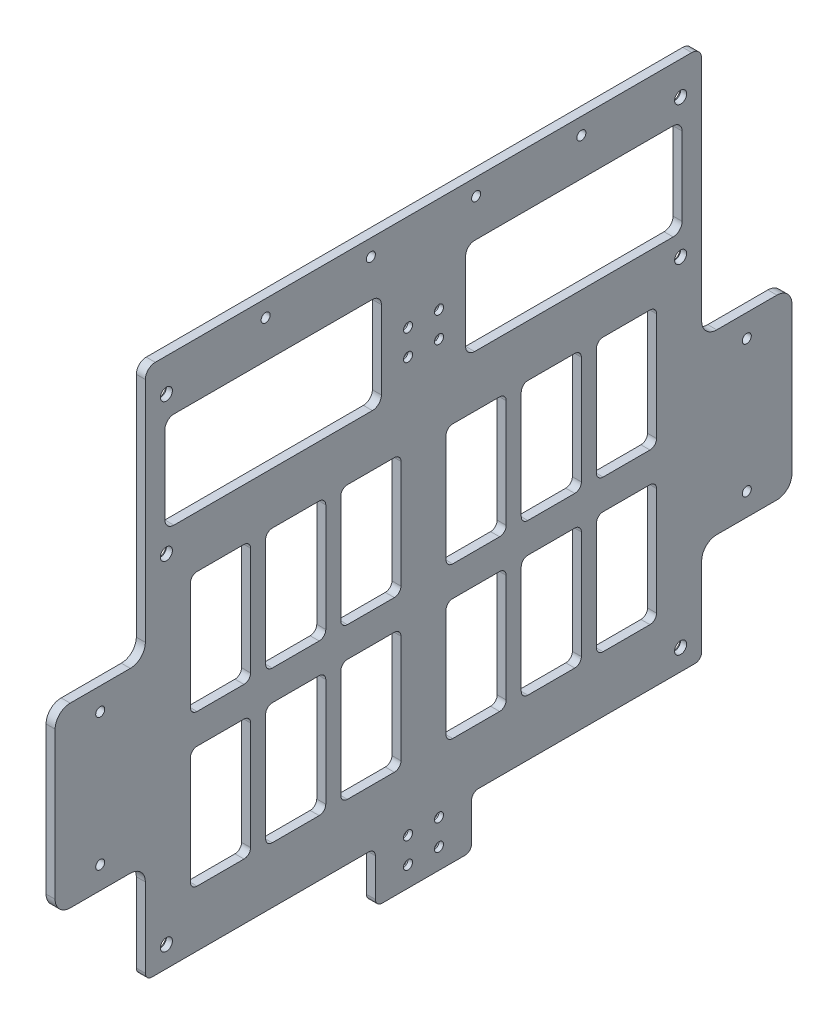
from build123d import *

# Parameters (mm, degrees)
EXTRUDE_1_DEPTH     = 3
SKETCH_2_R          = 1.5
SKETCH_2_R_2        = 2
CUT_EXTRUDE_1_DEPTH = 230.027574977
CHAMFER_2_SIZE      = 1.5
CHAMFER_3_SIZE      = 1


with BuildPart() as part:
    # 草图1 → 凸台-拉伸1 (new body)
    with BuildSketch(Plane(origin=(0, 0, 0), x_dir=(0, 0, -1), z_dir=(1, 0, 0))):
        with BuildLine():
            Line((13.8, 0), (-13.8, 0))
            ThreePointArc((-13.8, 0), (-15.355634919, 0.644365081), (-16, 2.2))
            Line((-16, 2.2), (-16, 14.79))
            ThreePointArc((-16, 14.79), (-16.644365081, 16.345634919), (-18.2, 16.99))
            Line((-18.2, 16.99), (-90.3, 16.99))
            ThreePointArc((-90.3, 16.99), (-91.855634919, 17.634365081), (-92.5, 19.19))
            Line((-92.5, 19.19), (-92.5, 45.49))
            ThreePointArc((-92.5, 45.49), (-93.964466094, 49.025533906), (-97.5, 50.49))
            Line((-97.5, 50.49), (-117.5, 50.49))
            ThreePointArc((-117.5, 50.49), (-121.035533906, 51.954466094), (-122.5, 55.49))
            Line((-122.5, 55.49), (-122.5, 104.49))
            ThreePointArc((-122.5, 104.49), (-121.035533906, 108.025533906), (-117.5, 109.49))
            Line((-117.5, 109.49), (-97.5, 109.49))
            ThreePointArc((-97.5, 109.49), (-93.964466094, 110.954466094), (-92.5, 114.49))
            Line((-92.5, 114.49), (-92.5, 190.19))
            ThreePointArc((-92.5, 190.19), (-91.533452378, 192.523452378), (-89.2, 193.49))
            Line((-89.2, 193.49), (89.2, 193.49))
            ThreePointArc((89.2, 193.49), (91.533452378, 192.523452378), (92.5, 190.19))
            Line((92.5, 190.19), (92.5, 114.49))
            ThreePointArc((92.5, 114.49), (93.964466094, 110.954466094), (97.5, 109.49))
            Line((97.5, 109.49), (117.5, 109.49))
            ThreePointArc((117.5, 109.49), (121.035533906, 108.025533906), (122.5, 104.49))
            Line((122.5, 104.49), (122.5, 55.49))
            ThreePointArc((122.5, 55.49), (121.035533906, 51.954466094), (117.5, 50.49))
            Line((117.5, 50.49), (97.5, 50.49))
            ThreePointArc((97.5, 50.49), (93.964466094, 49.025533906), (92.5, 45.49))
            Line((92.5, 45.49), (92.5, 19.19))
            ThreePointArc((92.5, 19.19), (91.855634919, 17.634365081), (90.3, 16.99))
            Line((90.3, 16.99), (18.2, 16.99))
            ThreePointArc((18.2, 16.99), (16.644365081, 16.345634919), (16, 14.79))
            Line((16, 14.79), (16, 2.2))
            ThreePointArc((16, 2.2), (15.355634919, 0.644365081), (13.8, 0))
        make_face()
    extrude(amount=EXTRUDE_1_DEPTH)

    # 草图2 → 切除-拉伸1 (cut, through all)
    with BuildSketch(Plane(origin=(3, 0, 0), x_dir=(0, 0, -1), z_dir=(1, 0, 0))):
        with Locations((-107.5, 101.99)):
            Circle(SKETCH_2_R)
        with Locations((-107.5, 57.99)):
            Circle(SKETCH_2_R)
        with Locations((-52.5, 187.99)):
            Circle(SKETCH_2_R)
        with Locations((-17.5, 187.99)):
            Circle(SKETCH_2_R)
        with Locations(Location((17.5, 187.99, 0), (0, 0, 180))):
            Circle(SKETCH_2_R)
        with Locations(Location((52.5, 187.99, 0), (0, 0, 180))):
            Circle(SKETCH_2_R)
        with Locations(Location((107.5, 57.99, 0), (0, 0, 180))):
            Circle(SKETCH_2_R)
        with Locations(Location((107.5, 101.99, 0), (0, 0, 180))):
            Circle(SKETCH_2_R)
        with Locations((5.15, 15.26)):
            Circle(SKETCH_2_R)
        with Locations((5.15, 6.76)):
            Circle(SKETCH_2_R)
        with Locations(Location((-5.15, 6.76, 0), (0, 0, 180))):
            Circle(SKETCH_2_R)
        with Locations(Location((-5.15, 15.26, 0), (0, 0, 180))):
            Circle(SKETCH_2_R)
        with Locations((5.15, 161.5)):
            Circle(SKETCH_2_R)
        with Locations((5.15, 153)):
            Circle(SKETCH_2_R)
        with Locations(Location((-5.15, 153, 0), (0, 0, 180))):
            Circle(SKETCH_2_R)
        with Locations(Location((-5.15, 161.5, 0), (0, 0, 180))):
            Circle(SKETCH_2_R)
        with Locations((-85.5, 23.99)):
            Circle(SKETCH_2_R_2)
        with Locations((-85.5, 182.49)):
            Circle(SKETCH_2_R_2)
        with Locations((-85.5, 136.49)):
            Circle(SKETCH_2_R_2)
        with Locations(Location((85.5, 23.99, 0), (0, 0, 180))):
            Circle(SKETCH_2_R_2)
        with Locations(Location((85.5, 136.49, 0), (0, 0, 180))):
            Circle(SKETCH_2_R_2)
        with Locations(Location((85.5, 182.49, 0), (0, 0, 180))):
            Circle(SKETCH_2_R_2)
        with BuildLine():
            Line((-17, 143.49), (-83, 143.49))
            ThreePointArc((-83, 143.49), (-85.121320344, 144.368679656), (-86, 146.49))
            Line((-86, 146.49), (-86, 172.49))
            ThreePointArc((-86, 172.49), (-85.121320344, 174.611320344), (-83, 175.49))
            Line((-83, 175.49), (-17, 175.49))
            ThreePointArc((-17, 175.49), (-14.878679656, 174.611320344), (-14, 172.49))
            Line((-14, 172.49), (-14, 146.49))
            ThreePointArc((-14, 146.49), (-14.878679656, 144.368679656), (-17, 143.49))
        make_face()
        with BuildLine():
            Line((17, 143.49), (83, 143.49))
            ThreePointArc((83, 143.49), (85.121320344, 144.368679656), (86, 146.49))
            Line((86, 146.49), (86, 172.49))
            ThreePointArc((86, 172.49), (85.121320344, 174.611320344), (83, 175.49))
            Line((83, 175.49), (17, 175.49))
            ThreePointArc((17, 175.49), (14.878679656, 174.611320344), (14, 172.49))
            Line((14, 172.49), (14, 146.49))
            ThreePointArc((14, 146.49), (14.878679656, 144.368679656), (17, 143.49))
        make_face()
        with BuildLine():
            Line((-34.7, 126.29), (-50.3, 126.29))
            ThreePointArc((-50.3, 126.29), (-51.855634919, 125.645634919), (-52.5, 124.09))
            Line((-52.5, 124.09), (-52.5, 88.19))
            ThreePointArc((-52.5, 88.19), (-51.855634919, 86.634365081), (-50.3, 85.99))
            Line((-50.3, 85.99), (-34.7, 85.99))
            ThreePointArc((-34.7, 85.99), (-33.144365081, 86.634365081), (-32.5, 88.19))
            Line((-32.5, 88.19), (-32.5, 124.09))
            ThreePointArc((-32.5, 124.09), (-33.144365081, 125.645634919), (-34.7, 126.29))
        make_face()
        with BuildLine():
            Line((-9.7, 126.29), (-25.3, 126.29))
            ThreePointArc((-25.3, 126.29), (-26.855634919, 125.645634919), (-27.5, 124.09))
            Line((-27.5, 124.09), (-27.5, 88.19))
            ThreePointArc((-27.5, 88.19), (-26.855634919, 86.634365081), (-25.3, 85.99))
            Line((-25.3, 85.99), (-9.7, 85.99))
            ThreePointArc((-9.7, 85.99), (-8.144365081, 86.634365081), (-7.5, 88.19))
            Line((-7.5, 88.19), (-7.5, 124.09))
            ThreePointArc((-7.5, 124.09), (-8.144365081, 125.645634919), (-9.7, 126.29))
        make_face()
        with BuildLine():
            Line((-59.7, 126.29), (-75.3, 126.29))
            ThreePointArc((-75.3, 126.29), (-76.855634919, 125.645634919), (-77.5, 124.09))
            Line((-77.5, 124.09), (-77.5, 88.19))
            ThreePointArc((-77.5, 88.19), (-76.855634919, 86.634365081), (-75.3, 85.99))
            Line((-75.3, 85.99), (-59.7, 85.99))
            ThreePointArc((-59.7, 85.99), (-58.144365081, 86.634365081), (-57.5, 88.19))
            Line((-57.5, 88.19), (-57.5, 124.09))
            ThreePointArc((-57.5, 124.09), (-58.144365081, 125.645634919), (-59.7, 126.29))
        make_face()
        with BuildLine():
            Line((-34.7, 75.99), (-50.3, 75.99))
            ThreePointArc((-50.3, 75.99), (-51.855634919, 75.345634919), (-52.5, 73.79))
            Line((-52.5, 73.79), (-52.5, 37.89))
            ThreePointArc((-52.5, 37.89), (-51.855634919, 36.334365081), (-50.3, 35.69))
            Line((-50.3, 35.69), (-34.7, 35.69))
            ThreePointArc((-34.7, 35.69), (-33.144365081, 36.334365081), (-32.5, 37.89))
            Line((-32.5, 37.89), (-32.5, 73.79))
            ThreePointArc((-32.5, 73.79), (-33.144365081, 75.345634919), (-34.7, 75.99))
        make_face()
        with BuildLine():
            Line((-9.7, 75.99), (-25.3, 75.99))
            ThreePointArc((-25.3, 75.99), (-26.855634919, 75.345634919), (-27.5, 73.79))
            Line((-27.5, 73.79), (-27.5, 37.89))
            ThreePointArc((-27.5, 37.89), (-26.855634919, 36.334365081), (-25.3, 35.69))
            Line((-25.3, 35.69), (-9.7, 35.69))
            ThreePointArc((-9.7, 35.69), (-8.144365081, 36.334365081), (-7.5, 37.89))
            Line((-7.5, 37.89), (-7.5, 73.79))
            ThreePointArc((-7.5, 73.79), (-8.144365081, 75.345634919), (-9.7, 75.99))
        make_face()
        with BuildLine():
            Line((-59.7, 75.99), (-75.3, 75.99))
            ThreePointArc((-75.3, 75.99), (-76.855634919, 75.345634919), (-77.5, 73.79))
            Line((-77.5, 73.79), (-77.5, 37.89))
            ThreePointArc((-77.5, 37.89), (-76.855634919, 36.334365081), (-75.3, 35.69))
            Line((-75.3, 35.69), (-59.7, 35.69))
            ThreePointArc((-59.7, 35.69), (-58.144365081, 36.334365081), (-57.5, 37.89))
            Line((-57.5, 37.89), (-57.5, 73.79))
            ThreePointArc((-57.5, 73.79), (-58.144365081, 75.345634919), (-59.7, 75.99))
        make_face()
        with BuildLine():
            Line((77.5, 73.79), (77.5, 37.89))
            ThreePointArc((77.5, 37.89), (76.855634919, 36.334365081), (75.3, 35.69))
            Line((75.3, 35.69), (59.7, 35.69))
            ThreePointArc((59.7, 35.69), (58.144365081, 36.334365081), (57.5, 37.89))
            Line((57.5, 37.89), (57.5, 73.79))
            ThreePointArc((57.5, 73.79), (58.144365081, 75.345634919), (59.7, 75.99))
            Line((59.7, 75.99), (75.3, 75.99))
            ThreePointArc((75.3, 75.99), (76.855634919, 75.345634919), (77.5, 73.79))
        make_face()
        with BuildLine():
            Line((52.5, 73.79), (52.5, 37.89))
            ThreePointArc((52.5, 37.89), (51.855634919, 36.334365081), (50.3, 35.69))
            Line((50.3, 35.69), (34.7, 35.69))
            ThreePointArc((34.7, 35.69), (33.144365081, 36.334365081), (32.5, 37.89))
            Line((32.5, 37.89), (32.5, 73.79))
            ThreePointArc((32.5, 73.79), (33.144365081, 75.345634919), (34.7, 75.99))
            Line((34.7, 75.99), (50.3, 75.99))
            ThreePointArc((50.3, 75.99), (51.855634919, 75.345634919), (52.5, 73.79))
        make_face()
        with BuildLine():
            Line((27.5, 73.79), (27.5, 37.89))
            ThreePointArc((27.5, 37.89), (26.855634919, 36.334365081), (25.3, 35.69))
            Line((25.3, 35.69), (9.7, 35.69))
            ThreePointArc((9.7, 35.69), (8.144365081, 36.334365081), (7.5, 37.89))
            Line((7.5, 37.89), (7.5, 73.79))
            ThreePointArc((7.5, 73.79), (8.144365081, 75.345634919), (9.7, 75.99))
            Line((9.7, 75.99), (25.3, 75.99))
            ThreePointArc((25.3, 75.99), (26.855634919, 75.345634919), (27.5, 73.79))
        make_face()
        with BuildLine():
            Line((77.5, 124.09), (77.5, 88.19))
            ThreePointArc((77.5, 88.19), (76.855634919, 86.634365081), (75.3, 85.99))
            Line((75.3, 85.99), (59.7, 85.99))
            ThreePointArc((59.7, 85.99), (58.144365081, 86.634365081), (57.5, 88.19))
            Line((57.5, 88.19), (57.5, 124.09))
            ThreePointArc((57.5, 124.09), (58.144365081, 125.645634919), (59.7, 126.29))
            Line((59.7, 126.29), (75.3, 126.29))
            ThreePointArc((75.3, 126.29), (76.855634919, 125.645634919), (77.5, 124.09))
        make_face()
        with BuildLine():
            Line((52.5, 124.09), (52.5, 88.19))
            ThreePointArc((52.5, 88.19), (51.855634919, 86.634365081), (50.3, 85.99))
            Line((50.3, 85.99), (34.7, 85.99))
            ThreePointArc((34.7, 85.99), (33.144365081, 86.634365081), (32.5, 88.19))
            Line((32.5, 88.19), (32.5, 124.09))
            ThreePointArc((32.5, 124.09), (33.144365081, 125.645634919), (34.7, 126.29))
            Line((34.7, 126.29), (50.3, 126.29))
            ThreePointArc((50.3, 126.29), (51.855634919, 125.645634919), (52.5, 124.09))
        make_face()
        with BuildLine():
            Line((27.5, 124.09), (27.5, 88.19))
            ThreePointArc((27.5, 88.19), (26.855634919, 86.634365081), (25.3, 85.99))
            Line((25.3, 85.99), (9.7, 85.99))
            ThreePointArc((9.7, 85.99), (8.144365081, 86.634365081), (7.5, 88.19))
            Line((7.5, 88.19), (7.5, 124.09))
            ThreePointArc((7.5, 124.09), (8.144365081, 125.645634919), (9.7, 126.29))
            Line((9.7, 126.29), (25.3, 126.29))
            ThreePointArc((25.3, 126.29), (26.855634919, 125.645634919), (27.5, 124.09))
        make_face()
    extrude(amount=-CUT_EXTRUDE_1_DEPTH, mode=Mode.SUBTRACT)

    # 倒角2
    chamfer_2_edges = [part.edges().sort_by_distance(p)[0] for p in [
        (0, 6.76, 3.65),
        (0, 6.76, -3.65),
        (0, 15.26, -3.65),
        (0, 161.5, 3.65),
        (0, 153, 3.65),
        (0, 153, -3.65),
        (0, 161.5, -3.65),
        (0, 15.26, 3.65),
    ]]
    chamfer(chamfer_2_edges, length=CHAMFER_2_SIZE)

    # 倒角3
    chamfer_3_edges = [part.edges().sort_by_distance(p)[0] for p in [
        (0, 136.49, 87.5),
        (0, 182.49, 87.5),
        (0, 23.99, 87.5),
        (0, 23.99, -87.5),
        (0, 136.49, -87.5),
        (0, 182.49, -87.5),
    ]]
    chamfer(chamfer_3_edges, length=CHAMFER_3_SIZE)


solid = part.part
